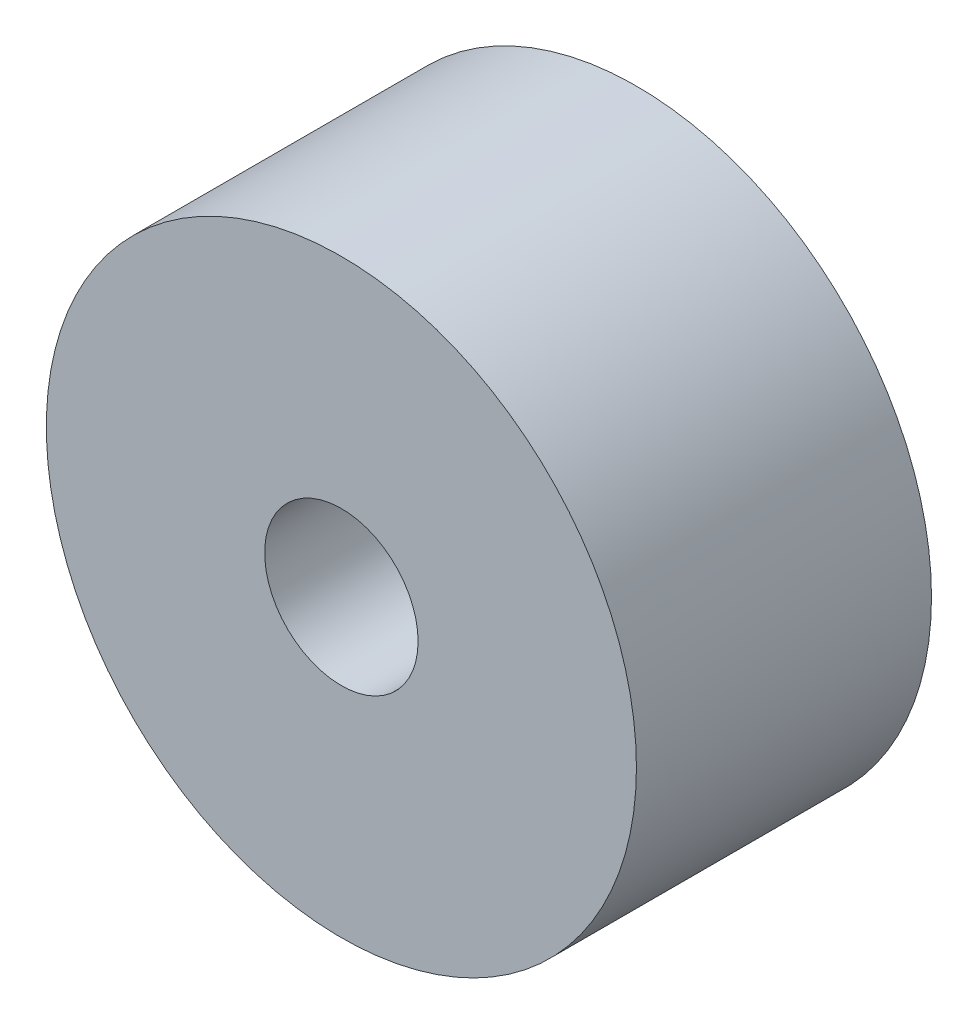
from build123d import *

# Parameters (mm, degrees)
SKETCH1_R           = 5
SKETCH1_R_2         = 1.3
BOSS_EXTRUDE1_DEPTH = 5


with BuildPart() as part:
    # Sketch1 → Boss-Extrude1 (new body)
    with BuildSketch(Plane.XY):
        Circle(SKETCH1_R)
        Circle(SKETCH1_R_2, mode=Mode.SUBTRACT)
    extrude(amount=BOSS_EXTRUDE1_DEPTH)


solid = part.part
